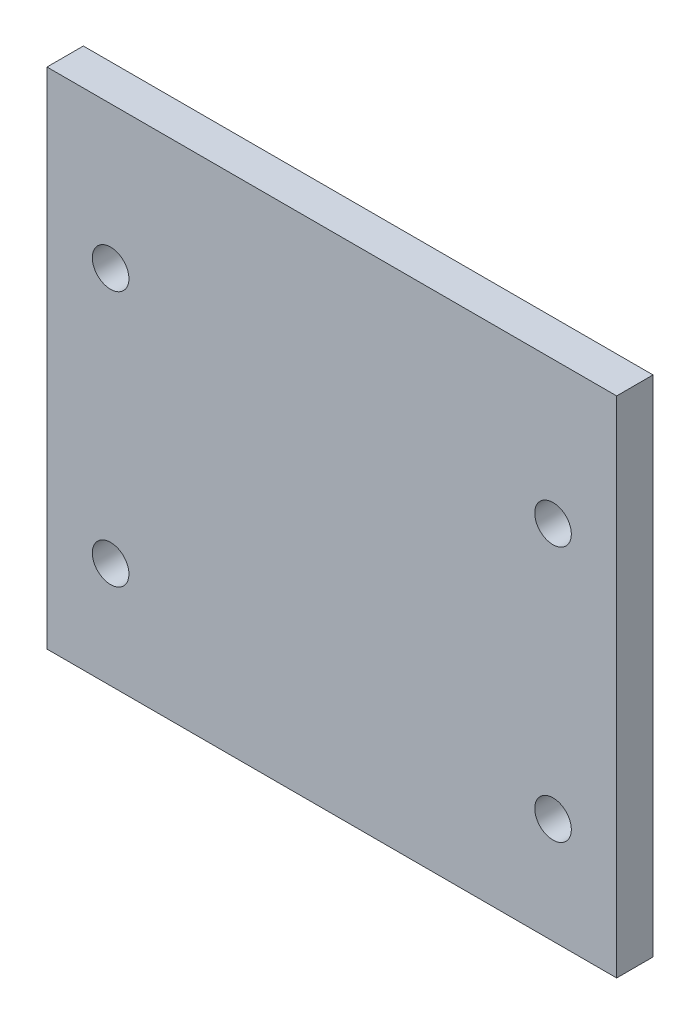
from build123d import *

# Parameters (mm, degrees)
SKETCH1_W           = 47
SKETCH1_H           = 41.59
SKETCH1_R           = 1.51
BOSS_EXTRUDE1_DEPTH = 3


with BuildPart() as part:
    # Sketch1 → Boss-Extrude1 (new body)
    with BuildSketch(Plane.XY):
        with Locations((23.5, 20.795)):
            Rectangle(SKETCH1_W, SKETCH1_H)
        with Locations((5.25, 8.74)):
            Circle(SKETCH1_R, mode=Mode.SUBTRACT)
        with Locations((41.75, 8.74)):
            Circle(SKETCH1_R, mode=Mode.SUBTRACT)
        with Locations((41.75, 29.84)):
            Circle(SKETCH1_R, mode=Mode.SUBTRACT)
        with Locations((5.25, 29.84)):
            Circle(SKETCH1_R, mode=Mode.SUBTRACT)
    extrude(amount=BOSS_EXTRUDE1_DEPTH)


solid = part.part
